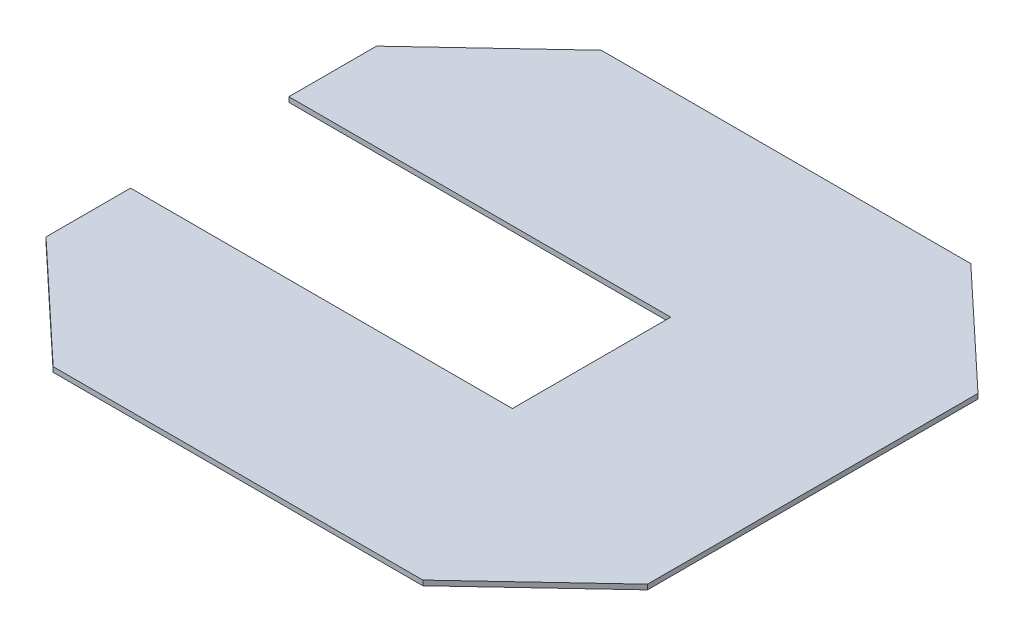
from build123d import *

# Parameters (mm, degrees)
EXTRUDE_1_DEPTH = 2.5


with BuildPart() as part:
    # Эскиз1 → Вытянуть1 (new body)
    with BuildSketch(Plane(origin=(0, 0, 0), x_dir=(1, 0, 0), z_dir=(0, 1, 0))):
        Polygon((-94.441508041, -137.752267566), (-153.072492047, -82.752267566), (-153.072492047, -40), (40, -40), (40, 40.061813782), (-153.072492047, 40.061813782), (-153.072492047, 84.365645152), (-94.441508041, 139.365645152), (92.431517161, 139.365645152), (151.062501167, 84.365645152), (151.062501167, -82.752267566), (92.431517161, -137.752267566), align=None)
    extrude(amount=EXTRUDE_1_DEPTH)


solid = part.part
